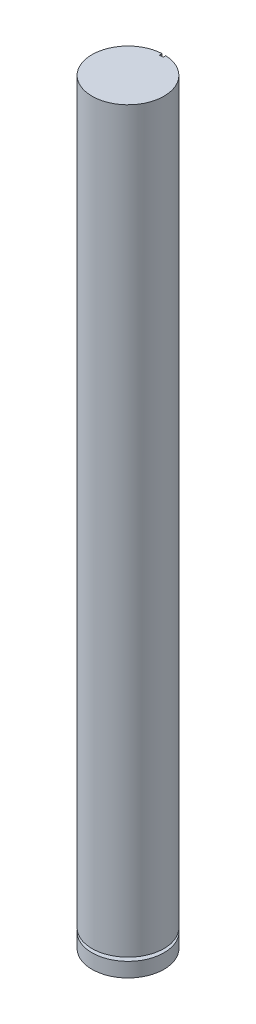
from build123d import *

# Parameters (mm, degrees)
SKETCH1_R           = 2
BOSS_EXTRUDE1_DEPTH = 42
SKETCH2_W           = 0.5
SKETCH2_H           = 0.2
SKETCH3_W           = 0.2
SKETCH3_H           = 0.15
CUT_EXTRUDE1_DEPTH  = 3


with BuildPart() as part:
    # Sketch1 → Boss-Extrude1 (new body)
    with BuildSketch(Plane(origin=(0, 0, 0), x_dir=(1, 0, 0), z_dir=(0, 1, 0))):
        with Locations(Location((0, 0, 0), (0, 0, 90))):
            Circle(SKETCH1_R)
    extrude(amount=BOSS_EXTRUDE1_DEPTH)

    # Sketch2 → Cut-Revolve1 (revolve, cut)
    with BuildSketch(Plane(origin=(0, 0, 0), x_dir=(0, 0, -1), z_dir=(1, 0, 0))):
        with Locations((1.75, 0.9)):
            Rectangle(SKETCH2_W, SKETCH2_H)
    revolve(axis=Axis((0, 0, 0), (0, 1, 0)), mode=Mode.SUBTRACT)

    # Sketch3 → Cut-Extrude1 (cut)
    with BuildSketch(Plane(origin=(0, 42, 0), x_dir=(1, 0, 0), z_dir=(0, 1, 0))):
        with Locations((0, 1.925)):
            Rectangle(SKETCH3_W, SKETCH3_H)
    extrude(amount=-CUT_EXTRUDE1_DEPTH, mode=Mode.SUBTRACT)


solid = part.part
